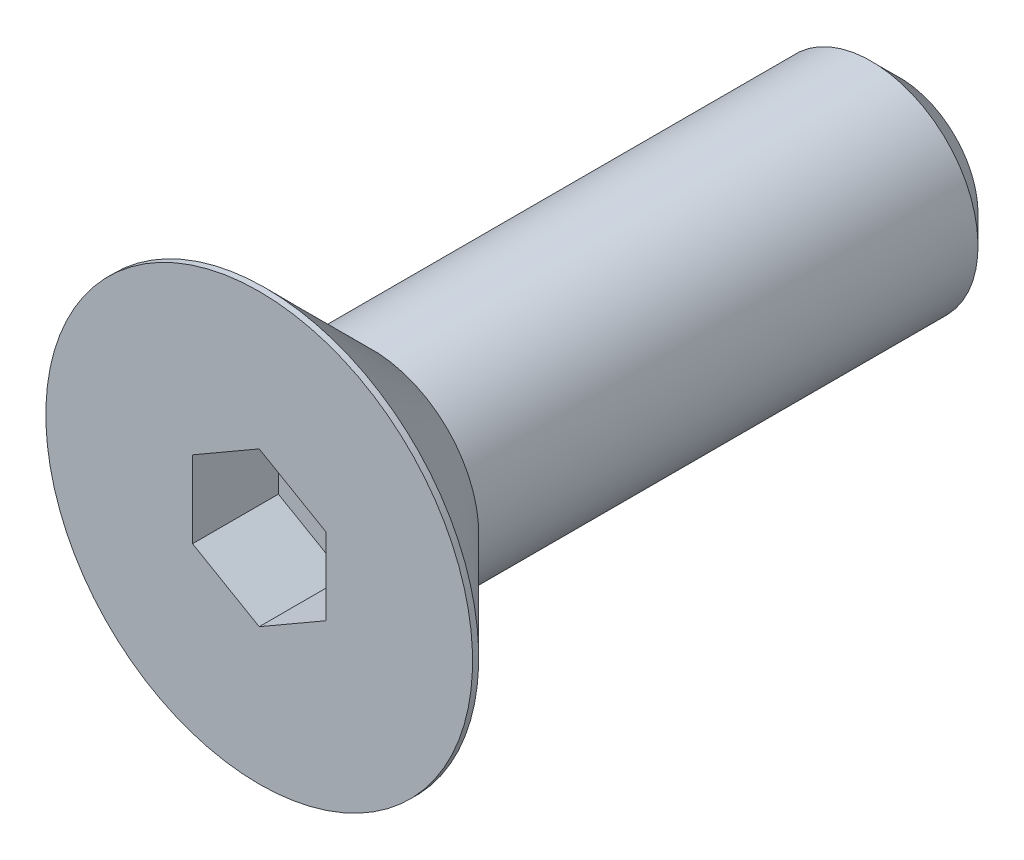
from build123d import *

# Parameters (mm, degrees)
CHAMFER1_SIZE      = 0.525
CUT_EXTRUDE2_DEPTH = 1.61


with BuildPart() as part:
    # Sketch1 → Revolve1 (revolve)
    with BuildSketch(Plane(origin=(0, 0, 0), x_dir=(0, 0, -1), z_dir=(1, 0, 0))):
        Polygon((-3.7, 2), (6, 2), (6, 0), (-4.39, 0), (-4.39, 2), align=None)
    revolve(axis=Axis((0, 0, 4.39), (0, 0, -1)))

    # Chamfer1
    chamfer1_edges = [part.edges().sort_by_distance(p)[0] for p in [
        (0, -2, -6),
    ]]
    chamfer(chamfer1_edges, length=CHAMFER1_SIZE)


with BuildPart() as body_2:
    # Sketch7 → Revolve2 (revolve)
    with BuildSketch(Plane(origin=(0, 0, 0), x_dir=(0, 0, -1), z_dir=(1, 0, 0))):
        Polygon((-5.885, 4), (-6, 4), (-6, 0), (-3.7, 0), (-3.7, 1.815), align=None)
    revolve(axis=Axis((0, 0, 6), (0, 0, -1)))

    # Sketch5 → Cut-Extrude2 (cut)
    with BuildSketch(Plane.XY.offset(6)):
        Polygon((1.25, -0.721687836), (1.25, 0.721687836), (0, 1.443375673), (-1.25, 0.721687836), (-1.25, -0.721687836), (0, -1.443375673), align=None)
    extrude(amount=-CUT_EXTRUDE2_DEPTH, mode=Mode.SUBTRACT)


solid = Compound([part.part, body_2.part])
